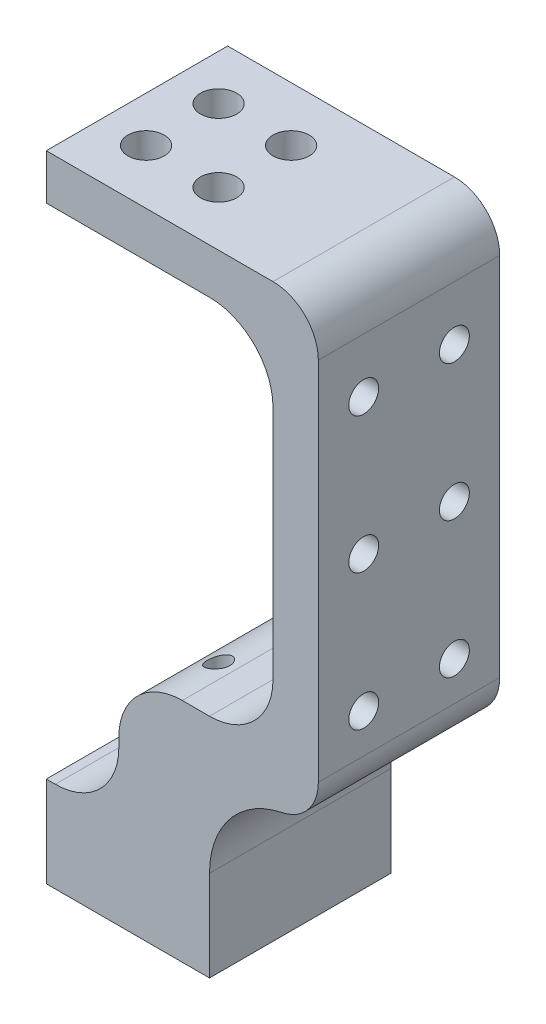
from build123d import *

# Parameters (mm, degrees)
SKETCH1_W                      = 20
SKETCH1_H                      = 70
BOSS_EXTRUDE1_DEPTH            = 30
SKETCH2_W                      = 12
SKETCH2_H                      = 20
CUT_EXTRUDE1_DEPTH             = 51.249378106
FILLET1_R                      = 10
FILLET2_R                      = 5
CUT_EXTRUDE2_DEPTH             = 51.249378275
FILLET3_R                      = 7
FILLET4_R                      = 7
F_4_0_REAMED_HOLE_D            = 4
F_4_0_REAMED_HOLE_DEPTH        = 5
M3X0_5_TAPPED_HOLE1_D          = 2.5
F_4_0_REAMED_HOLE_BOTTOM_D     = 4
F_4_0_REAMED_HOLE_BOTTOM_DEPTH = 5
F_4_0_REAMED_HOLE_BOTTOM_TIP   = 1.201721238
M4X0_7_TAPPED_HOLE1_D          = 3.3
M4X0_7_TAPPED_HOLE1_DEPTH      = 10.1
M4X0_7_TAPPED_HOLE1_TIP        = 0.991420021


with BuildPart() as part:
    # Sketch1 → Boss-Extrude1 (new body)
    with BuildSketch(Plane(origin=(0, 0, 0), x_dir=(0, 0, -1), z_dir=(1, 0, 0))):
        Rectangle(SKETCH1_W, SKETCH1_H)
    extrude(amount=BOSS_EXTRUDE1_DEPTH)

    # Sketch2 → Cut-Extrude1 (cut, through all)
    with BuildSketch(Plane.XY.offset(10)):
        with Locations((24, -25)):
            Rectangle(SKETCH2_W, SKETCH2_H)
    extrude(amount=-CUT_EXTRUDE1_DEPTH, mode=Mode.SUBTRACT)

    # Fillet1
    fillet1_edges = [part.edges().sort_by_distance(p)[0] for p in [
        (18, -15, 0),
    ]]
    fillet(fillet1_edges, radius=FILLET1_R)

    # Fillet2
    fillet2_edges = [part.edges().sort_by_distance(p)[0] for p in [
        (30, 35, 0),
        (30, -15, 0),
    ]]
    fillet(fillet2_edges, radius=FILLET2_R)

    # Sketch6 → Cut-Extrude2 (cut, through all)
    with BuildSketch(Plane.XY.offset(10)):
        Polygon((0, 30), (25, 30), (25, -10), (8, -10), (8, -25), (0, -25), align=None)
    extrude(amount=-CUT_EXTRUDE2_DEPTH, mode=Mode.SUBTRACT)

    # Fillet3
    fillet3_edges = [part.edges().sort_by_distance(p)[0] for p in [
        (25, 30, 0),
        (25, -10, 0),
        (8, -25, 0),
    ]]
    fillet(fillet3_edges, radius=FILLET3_R)

    # Fillet4
    fillet4_edges = [part.edges().sort_by_distance(p)[0] for p in [
        (8, -10, 0),
    ]]
    fillet(fillet4_edges, radius=FILLET4_R)

    # Ø4.0 Reamed hole
    with Locations(Plane(origin=(0, 35, 0), x_dir=(1, 0, 0), z_dir=(0, 1, 0))):
        with Locations((5, -4), (5, 4), (13, 4), (13, -4)):
            Hole(F_4_0_REAMED_HOLE_D / 2, depth=F_4_0_REAMED_HOLE_DEPTH)

    # M3x0.5 Tapped Hole1 (through all)
    with Locations(Plane(origin=(0, -35, 0), x_dir=(-1, 0, 0), z_dir=(0, -1, 0))):
        with Locations((-5, -4), (-13, -4), (-5, 4), (-13, 4)):
            Hole(M3X0_5_TAPPED_HOLE1_D / 2)

    # Ø4.0 Reamed hole, bottom
    with Locations(Plane(origin=(0, -35, 0), x_dir=(-1, 0, 0), z_dir=(0, -1, 0))):
        with Locations((-5, -4), (-13, -4), (-13, 4), (-5, 4)):
            Hole(F_4_0_REAMED_HOLE_BOTTOM_D / 2, depth=F_4_0_REAMED_HOLE_BOTTOM_DEPTH)
            with Locations((0, 0, -(F_4_0_REAMED_HOLE_BOTTOM_DEPTH + F_4_0_REAMED_HOLE_BOTTOM_TIP / 2))):  # 118° drill point
                Cone(0, F_4_0_REAMED_HOLE_BOTTOM_D / 2, F_4_0_REAMED_HOLE_BOTTOM_TIP, mode=Mode.SUBTRACT)

    # M4x0.7 Tapped Hole1
    with Locations(Plane(origin=(30, 0, 0), x_dir=(0, 0, -1), z_dir=(1, 0, 0))):
        with Locations((-5, 24), (5, 24), (-5, 9), (5, 9), (-5, -6), (5, -6)):
            Hole(M4X0_7_TAPPED_HOLE1_D / 2, depth=M4X0_7_TAPPED_HOLE1_DEPTH)
            with Locations((0, 0, -(M4X0_7_TAPPED_HOLE1_DEPTH + M4X0_7_TAPPED_HOLE1_TIP / 2))):  # 118° drill point
                Cone(0, M4X0_7_TAPPED_HOLE1_D / 2, M4X0_7_TAPPED_HOLE1_TIP, mode=Mode.SUBTRACT)


solid = part.part
